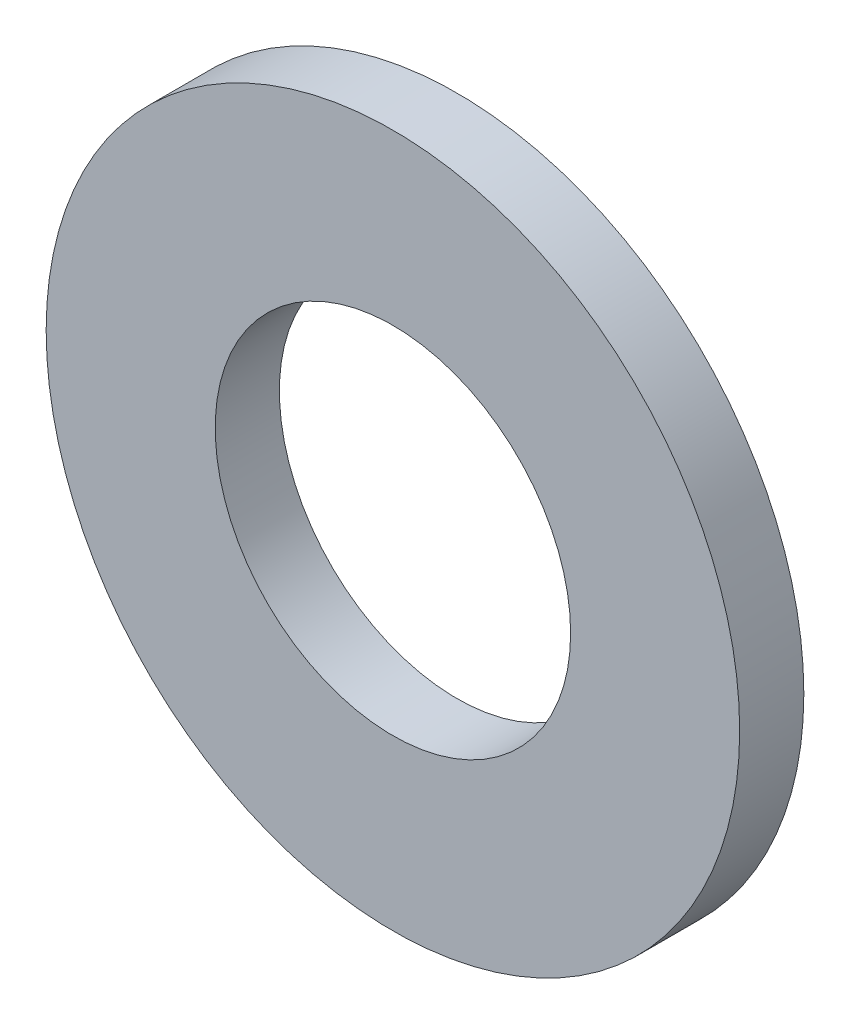
from build123d import *

# Parameters (mm, degrees)
SKETCH1_R           = 25.4
SKETCH1_R_2         = 13.0175
BOSS_EXTRUDE1_DEPTH = 4.699


with BuildPart() as part:
    # Sketch1 → Boss-Extrude1 (new body)
    with BuildSketch(Plane.XY):
        Circle(SKETCH1_R)
        Circle(SKETCH1_R_2, mode=Mode.SUBTRACT)
    extrude(amount=BOSS_EXTRUDE1_DEPTH)


solid = part.part
